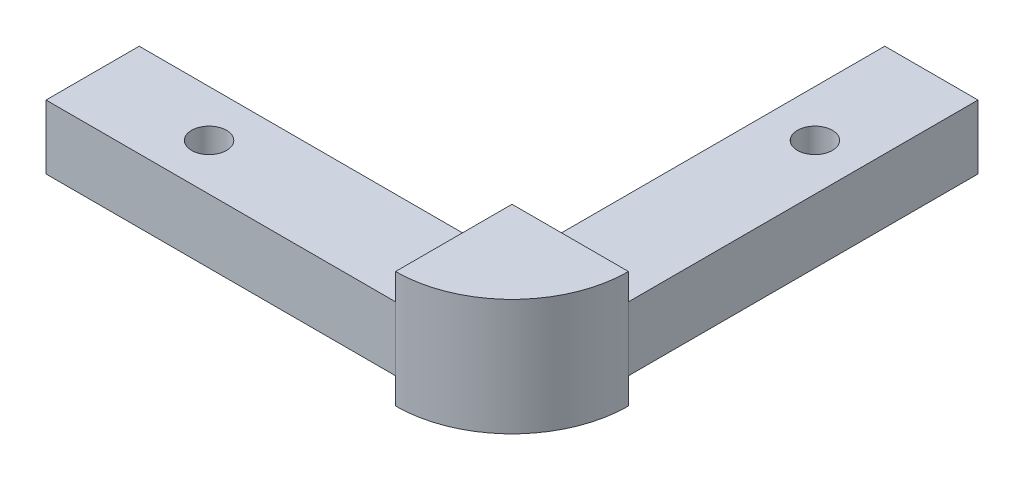
from build123d import *

# Parameters (mm, degrees)
EXTRUDE_5_DEPTH      = 5.5
EXTRUDE_7_DEPTH      = 2.25
EXTRUDE_7_DEPTH_BACK = 7.75
SKETCH_7_R           = 1.5
CUT_EXTRUDE_1_DEPTH  = 10


with BuildPart() as part:
    # 草图5 → 凸台-拉伸5 (new body)
    with BuildSketch(Plane(origin=(0, 0, 0), x_dir=(1, 0, 0), z_dir=(0, 1, 0))):
        with BuildLine():
            Line((-34.334210338, 14.7736082), (-32.334210338, 14.7736082))
            Line((-32.334210338, 14.7736082), (-32.334210338, 44.7736082))
            Line((-32.334210338, 44.7736082), (-24.334210338, 44.7736082))
            Line((-24.334210338, 44.7736082), (-24.334210338, 14.7736082))
            ThreePointArc((-24.334210338, 14.7736082), (-27.263142526, 7.702540389), (-34.334210338, 4.7736082))
            Line((-34.334210338, 4.7736082), (-64.334210338, 4.7736082))
            Line((-64.334210338, 4.7736082), (-64.334210338, 12.7736082))
            Line((-64.334210338, 12.7736082), (-34.334210338, 12.7736082))
            Line((-34.334210338, 12.7736082), (-34.334210338, 14.7736082))
        make_face()
    extrude(amount=EXTRUDE_5_DEPTH)

    # 草图6 → 凸台-拉伸7 (add, two sides: drawn at the far end of the back side and taken through both)
    with BuildSketch(Plane(origin=(0, 5.5, 0), x_dir=(1, 0, 0), z_dir=(0, 1, 0)).offset(-EXTRUDE_7_DEPTH_BACK)):
        with BuildLine():
            Line((-34.334210338, 14.7736082), (-24.334210338, 14.7736082))
            ThreePointArc((-24.334210338, 14.7736082), (-27.263142526, 7.702540389), (-34.334210338, 4.7736082))
            Line((-34.334210338, 4.7736082), (-34.334210338, 14.7736082))
        make_face()
    extrude(amount=EXTRUDE_7_DEPTH + EXTRUDE_7_DEPTH_BACK)

    # 草图7 → 切除-拉伸1 (cut)
    with BuildSketch(Plane(origin=(0, 5.5, 0), x_dir=(1, 0, 0), z_dir=(0, 1, 0))):
        with Locations(Location((-54.334210338, 8.7736082, 0), (0, 0, 270))):
            Circle(SKETCH_7_R)
        with Locations(Location((-28.334210338, 34.7736082, 0), (0, 0, 270))):
            Circle(SKETCH_7_R)
    extrude(amount=-CUT_EXTRUDE_1_DEPTH, mode=Mode.SUBTRACT)


solid = part.part
